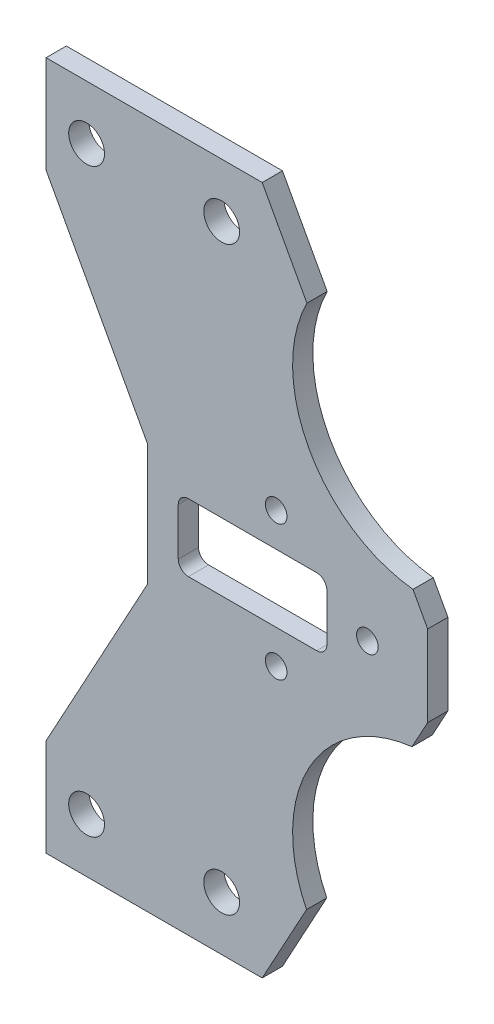
from build123d import *

# Parameters (mm, degrees)
SKETCH1_R          = 2.65
SKETCH1_R_2        = 1.6
EXTRUDE1_DEPTH     = 3
SKETCH2_R          = 20
CUT_EXTRUDE1_DEPTH = 3


with BuildPart() as part:
    # Sketch1 → Extrude1 (new body)
    with BuildSketch(Plane.XY):
        Polygon((-33.99999989, 52.265), (-33.99999989, 37.844541986), (-18.99999989, 10.293251102), (-18.99999989, -7.768251102), (-33.99999989, -35.319541986), (-33.99999989, -49.74), (-2, -49.74), (22.501120576, -4.7375), (22.501120576, 7.2625), (-2, 52.265), align=None)
        with Locations((-27.99999989, 44.265)):
            Circle(SKETCH1_R, mode=Mode.SUBTRACT)
        with Locations((-8, 44.262899898)):
            Circle(SKETCH1_R, mode=Mode.SUBTRACT)
        with Locations((-27.99999989, -41.737899898)):
            Circle(SKETCH1_R, mode=Mode.SUBTRACT)
        with Locations((-8, -41.74)):
            Circle(SKETCH1_R, mode=Mode.SUBTRACT)
        with Locations((0.071120582, 11.2625)):
            Circle(SKETCH1_R_2, mode=Mode.SUBTRACT)
        with Locations((13.571120582, 1.2625)):
            Circle(SKETCH1_R_2, mode=Mode.SUBTRACT)
        with Locations((0.071120582, -8.7375)):
            Circle(SKETCH1_R_2, mode=Mode.SUBTRACT)
        with BuildLine():
            Line((7.571120582, -2.2375), (7.571120582, 4.7625))
            ThreePointArc((7.571120582, 4.7625), (7.131780753, 5.823160172), (6.071120582, 6.2625))
            Line((6.071120582, 6.2625), (-12.928879418, 6.2625))
            ThreePointArc((-12.928879418, 6.2625), (-13.98953959, 5.823160172), (-14.428879418, 4.7625))
            Line((-14.428879418, 4.7625), (-14.428879418, -2.2375))
            ThreePointArc((-14.428879418, -2.2375), (-13.98953959, -3.298160172), (-12.928879418, -3.7375))
            Line((-12.928879418, -3.7375), (6.071120582, -3.7375))
            ThreePointArc((6.071120582, -3.7375), (7.131780753, -3.298160172), (7.571120582, -2.2375))
        make_face(mode=Mode.SUBTRACT)
    extrude(amount=EXTRUDE1_DEPTH)

    # Sketch2 → Cut-Extrude1 (cut)
    with BuildSketch(Plane.XY.offset(3)):
        with Locations((22.501120582, 31.14)):
            Circle(SKETCH2_R)
        with Locations((22.501120582, -28.86)):
            Circle(SKETCH2_R)
    extrude(amount=-CUT_EXTRUDE1_DEPTH, mode=Mode.SUBTRACT)


solid = part.part
